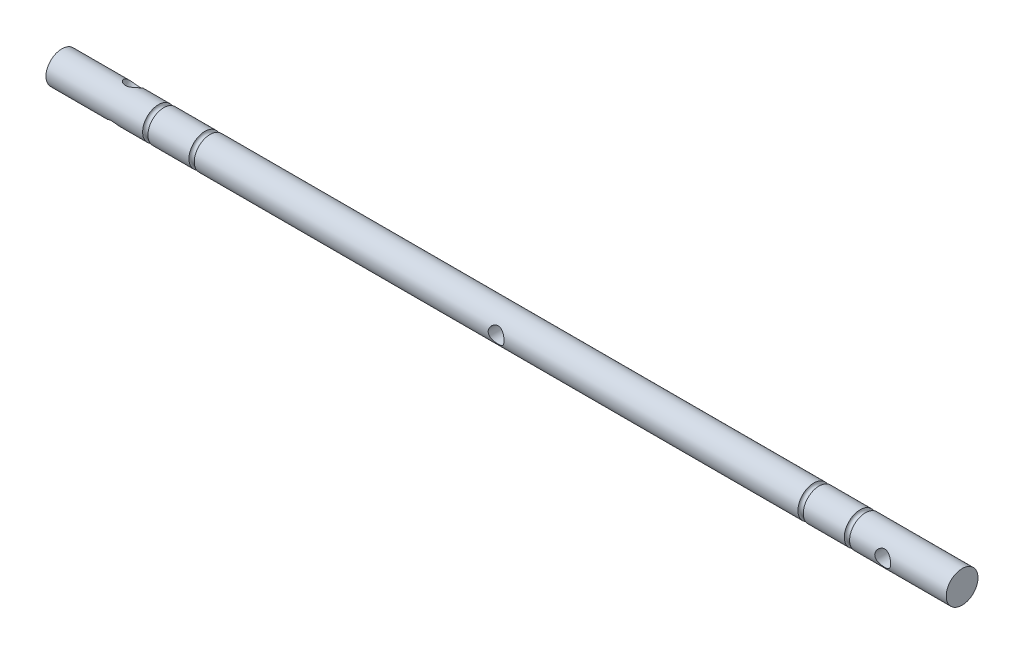
from build123d import *

# Parameters (mm, degrees)
SKETCH1_R               = 3
BOSS_EXTRUDE1_DEPTH     = 170
CUT_EXTRUDE1_DEPTH      = 171.052932936
CUT_EXTRUDE1_DEPTH_BACK = 171.052932936
SKETCH2_R               = 1.5
CUT_EXTRUDE2_DEPTH      = 171.052933039
CUT_EXTRUDE2_DEPTH_BACK = 171.052933039
SKETCH3_R               = 1.5
CUT_SWEEP1_PROFILE_R    = 0.5
LPATTERN1_COUNT         = 2
LPATTERN1_PITCH         = 8.75
MIRROR1_COPY_1_SKETCH_R = 0.5


with BuildPart() as part:
    # Sketch1 → Boss-Extrude1 (new body)
    with BuildSketch(Plane.YZ):
        with Locations(Location((0, 0, 0), (0, 0, 270))):
            Circle(SKETCH1_R)
    extrude(amount=BOSS_EXTRUDE1_DEPTH)

    # Sketch2 → Cut-Extrude1 (cut, two sides: drawn at the far end of the back side and taken through both)
    with BuildSketch(Plane(origin=(0, 0, 0), x_dir=(0, 1, 0), z_dir=(0, 0, 1)).offset(-CUT_EXTRUDE1_DEPTH_BACK)):
        with Locations(Location((0, -158, 0), (0, 0, 270))):
            Circle(SKETCH2_R)
        with Locations(Location((0, -85, 0), (0, 0, 270))):
            Circle(SKETCH2_R)
    extrude(amount=CUT_EXTRUDE1_DEPTH + CUT_EXTRUDE1_DEPTH_BACK, mode=Mode.SUBTRACT)

    # Sketch3 → Cut-Extrude2 (cut, two sides: drawn at the far end of the back side and taken through both)
    with BuildSketch(Plane(origin=(0, 0, 0), x_dir=(-1, 0, 0), z_dir=(0, 0.8660254037844364, -0.5000000000000041)).offset(-CUT_EXTRUDE2_DEPTH_BACK)):
        with Locations(Location((-12, 0, 0), (0, 0, 90))):
            Circle(SKETCH3_R)
    extrude(amount=CUT_EXTRUDE2_DEPTH + CUT_EXTRUDE2_DEPTH_BACK, mode=Mode.SUBTRACT)

    # Cut-Sweep1: sweep along a path in Sketch4
    with BuildLine(Plane.YZ.offset(151.25)) as cut_sweep1_path:
        CenterArc((0, 0), 3, 0, 360)
    # Cut-Sweep1 profile (on start of the path) → Cut-Sweep1 (sweep, cut)
    with BuildSketch(Plane(origin=(151.25, 3, 0), x_dir=(1, 0, 0), z_dir=(0, 0, 1))):
        Circle(CUT_SWEEP1_PROFILE_R)
    cut_sweep1 = sweep(path=cut_sweep1_path.line, mode=Mode.SUBTRACT)

    # LPattern1: Cut-Sweep1 ×2
    with Locations(*[(-i * LPATTERN1_PITCH, 0, 0) for i in range(1, LPATTERN1_COUNT)]):
        add(cut_sweep1, mode=Mode.SUBTRACT)

    # Mirror1: Cut-Sweep1 across plane
    add(cut_sweep1.mirror(Plane(origin=(85, 0, 0), x_dir=(0, 0, 1), z_dir=(1, 0, 0))), mode=Mode.SUBTRACT)

    # Mirror1 copy 1: sweep along a path in Mirror1 copy 1 path
    with BuildLine(Plane(origin=(27.5, 0, 0), x_dir=(0, 1, 0), z_dir=(-1, 0, 0))) as mirror1_copy_1_path:
        CenterArc((0, 0), 3, 0, 360)
    # Mirror1 copy 1 sketch → Mirror1 copy 1 (sweep, cut)
    with BuildSketch(Plane(origin=(27.5, 3, 0), x_dir=(-1, 0, 0), z_dir=(0, 0, 1))):
        Circle(MIRROR1_COPY_1_SKETCH_R)
    sweep(path=mirror1_copy_1_path.line, mode=Mode.SUBTRACT)


solid = part.part
